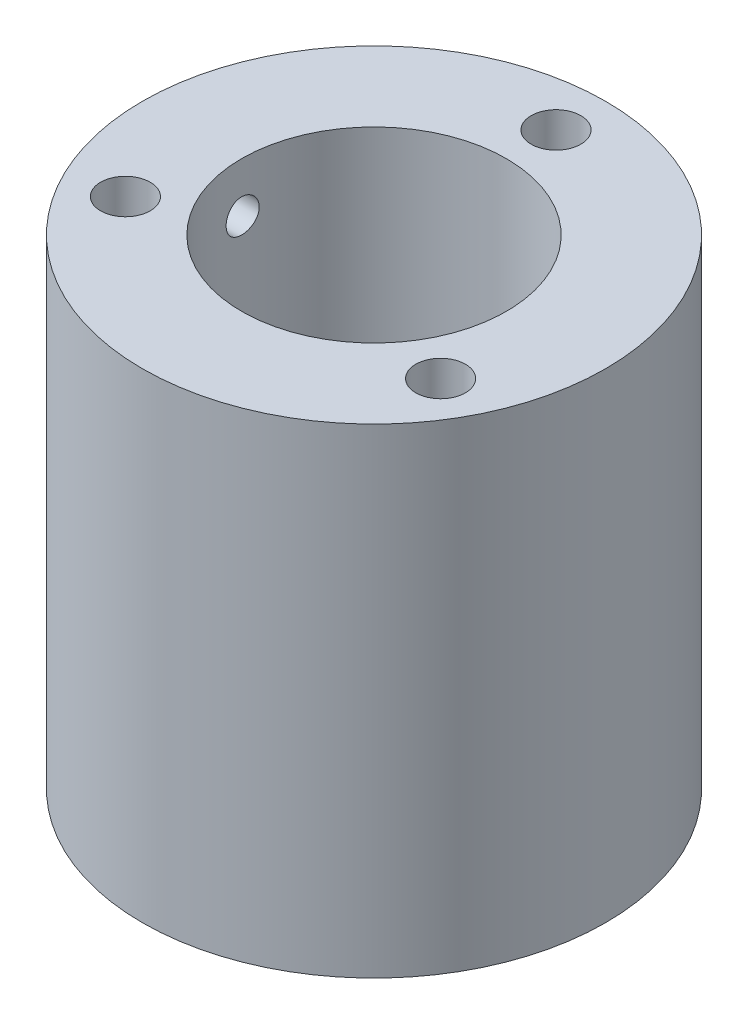
from build123d import *

# Parameters (mm, degrees)
ESQUISSE2_R             = 1.5
ENL_V_MAT_EXTRU_1_DEPTH = 10
ESQUISSE3_R             = 8
ENL_V_MAT_EXTRU_2_DEPTH = 25
ESQUISSE4_R             = 1
ENL_V_MAT_EXTRU_3_DEPTH = 25


with BuildPart() as part:
    # Esquisse1 → Révolution1 (revolve)
    with BuildSketch(Plane.XY):
        Polygon((8, 0), (8, 1.5), (14, 1.5), (14, 30.5), (8, 30.5), (8, 32), (3, 32), (3, 0), align=None)
    revolve(axis=Axis((0, 0, 0), (0, 1, 0)))

    # Esquisse2 → Enlèv. mat.-Extru.1 (cut)
    with BuildSketch(Plane(origin=(0, 30.5, 0), x_dir=(1, 0, 0), z_dir=(0, 1, 0))):
        with Locations(Location((0, 11, 0), (0, 0, 180))):
            Circle(ESQUISSE2_R)
        with Locations(Location((9.526279442, -5.5, 0), (0, 0, 180))):
            Circle(ESQUISSE2_R)
        with Locations(Location((-9.526279442, -5.5, 0), (0, 0, 180))):
            Circle(ESQUISSE2_R)
    extrude(amount=-ENL_V_MAT_EXTRU_1_DEPTH, mode=Mode.SUBTRACT)

    # Esquisse3 → Enlèv. mat.-Extru.2 (cut)
    with BuildSketch(Plane(origin=(0, 32, 0), x_dir=(1, 0, 0), z_dir=(0, 1, 0))):
        Circle(ESQUISSE3_R)
    extrude(amount=-ENL_V_MAT_EXTRU_2_DEPTH, mode=Mode.SUBTRACT)

    # Esquisse4 → Enlèv. mat.-Extru.3 (cut)
    with BuildSketch(Plane(origin=(0, 0, 0), x_dir=(0, 0, -1), z_dir=(1, 0, 0))):
        with Locations((0, 27.5)):
            Circle(ESQUISSE4_R)
    extrude(amount=-ENL_V_MAT_EXTRU_3_DEPTH, mode=Mode.SUBTRACT)


solid = part.part
